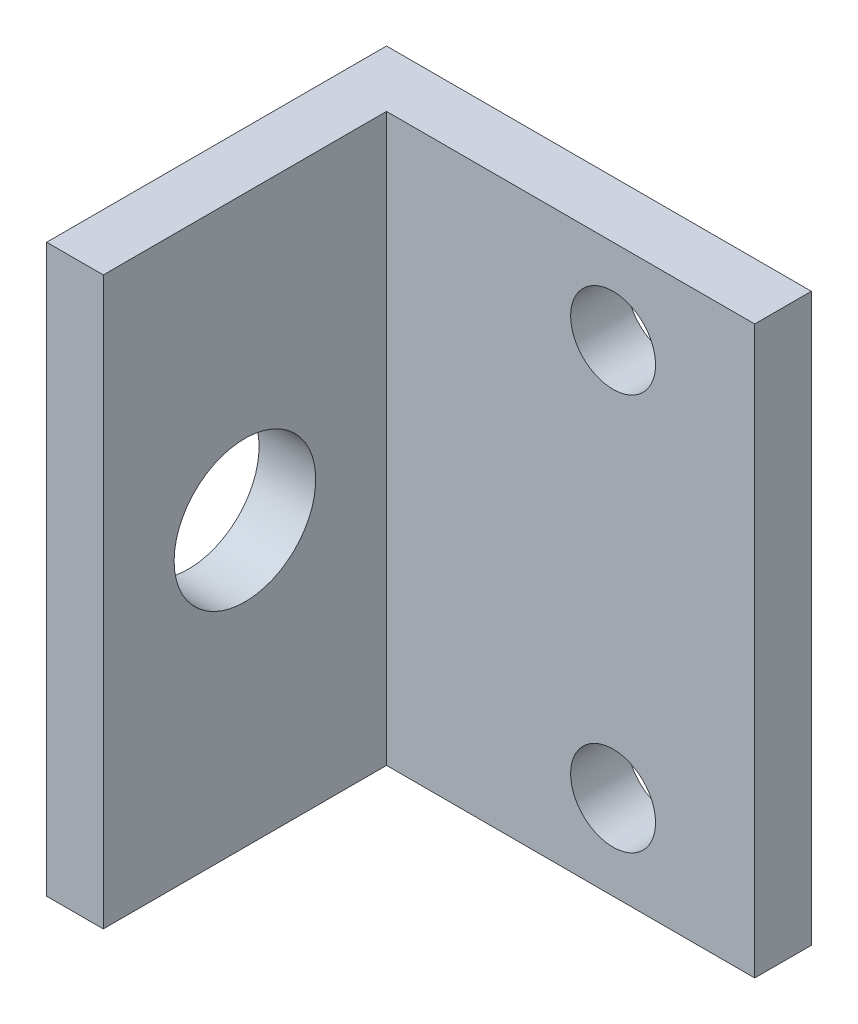
from build123d import *

# Parameters (mm, degrees)
EXTRUDE_THIN1_DEPTH = 20
SKETCH2_R           = 2.5
CUT_EXTRUDE1_DEPTH  = 10
SKETCH3_R           = 1.5
CUT_EXTRUDE2_DEPTH  = 10


with BuildPart() as part:
    # Sketch1 → Extrude-Thin1 (new body)
    with BuildSketch(Plane(origin=(0, 0, 0), x_dir=(1, 0, 0), z_dir=(0, 1, 0))):
        Polygon((0, 0), (0, 12), (15, 12), (15, 10), (2, 10), (2, 0), align=None)
    extrude(amount=EXTRUDE_THIN1_DEPTH)

    # Sketch2 → Cut-Extrude1 (cut)
    with BuildSketch(Plane.ZY):
        with Locations((-5, 10)):
            Circle(SKETCH2_R)
    extrude(amount=-CUT_EXTRUDE1_DEPTH, mode=Mode.SUBTRACT)

    # Sketch3 → Cut-Extrude2 (cut)
    with BuildSketch(Plane(origin=(0, 0, -12), x_dir=(-1, 0, 0), z_dir=(0, 0, -1))):
        with Locations((-10, 17)):
            Circle(SKETCH3_R)
        with Locations((-10, 3)):
            Circle(SKETCH3_R)
    extrude(amount=-CUT_EXTRUDE2_DEPTH, mode=Mode.SUBTRACT)


solid = part.part
